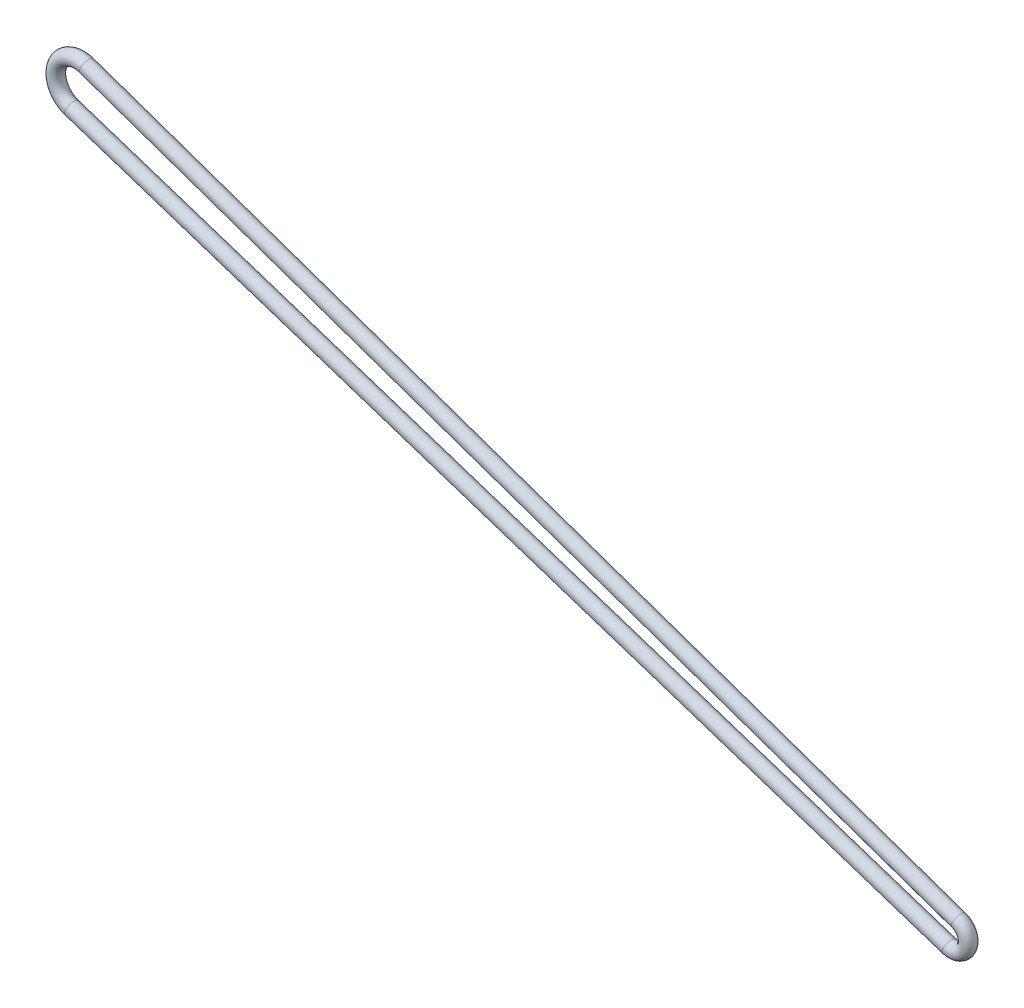
from build123d import *

# Parameters (mm, degrees)
SWEEP_19_PROFILE_R = 1.5


with BuildPart() as part:
    # 扫描19: sweep along a path in 草图2
    with BuildLine(Plane.XY) as sweep_19_path:
        Line((293.74272631, 74.363774443), (104.281932756, 136.393656186))
        ThreePointArc((104.281932756, 136.393656186), (101.100922494, 142.74642604), (107.483719579, 145.866748534))
        Line((107.483719579, 145.866748534), (295.72783414, 80.237091699))
        ThreePointArc((295.72783414, 80.237091699), (297.644083944, 76.317293767), (293.74272631, 74.363774443))
    # 扫描19 profile (on start of the path) → 扫描19 (sweep)
    with BuildSketch(Plane(origin=(293.74272631, 74.363774443, 0), x_dir=(-0.3111502050570295, -0.9503607472391569, 0), z_dir=(-0.9503607472391569, 0.3111502050570295, 0))):
        Circle(SWEEP_19_PROFILE_R)
    sweep(path=sweep_19_path.line)


solid = part.part
